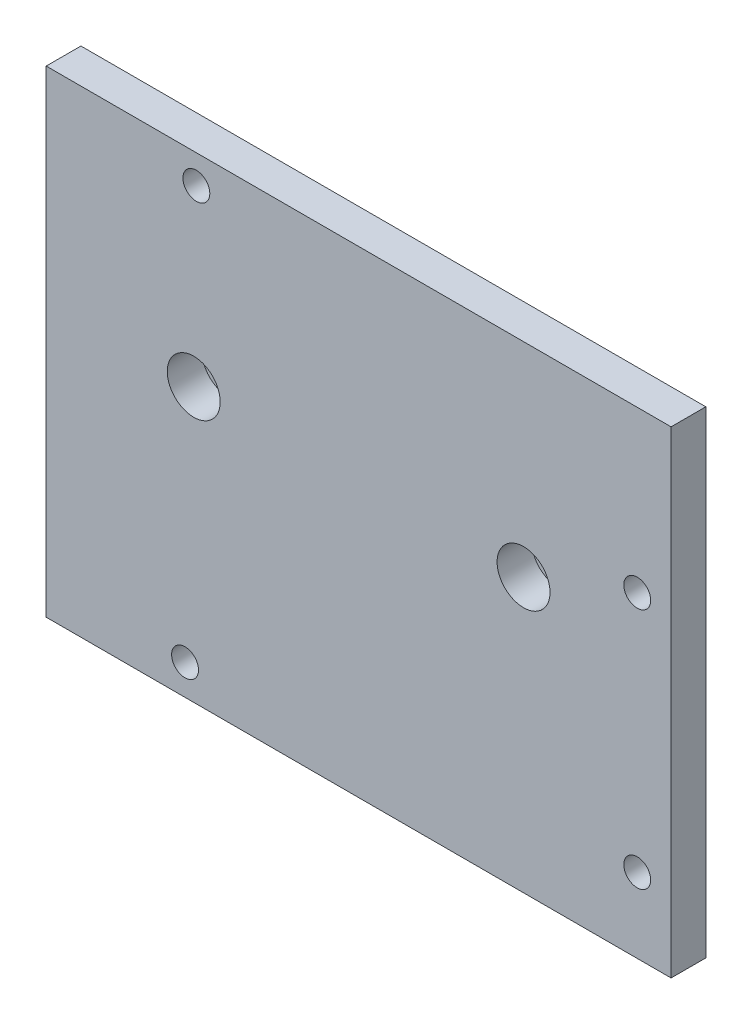
from build123d import *

# Parameters (mm, degrees)
SKETCH1_W           = 58
SKETCH1_H           = 12
SKETCH1_R           = 1.55
BOSS_EXTRUDE1_DEPTH = 6
SKETCH2_W           = 72
SKETCH2_H           = 55
SKETCH2_R           = 1.55
SKETCH2_R_2         = 3.05
BOSS_EXTRUDE2_DEPTH = 4


with BuildPart() as part:
    # Sketch1 → Boss-Extrude1 (new body)
    with BuildSketch(Plane.XY):
        Rectangle(SKETCH1_W, SKETCH1_H)
        with Locations((-19, 0)):
            Circle(SKETCH1_R, mode=Mode.SUBTRACT)
        with Locations((19, 0)):
            Circle(SKETCH1_R, mode=Mode.SUBTRACT)
    extrude(amount=BOSS_EXTRUDE1_DEPTH)

    # Sketch2 → Boss-Extrude2 (add)
    with BuildSketch(Plane.XY.offset(6)):
        with Locations((0, -4)):
            Rectangle(SKETCH2_W, SKETCH2_H)
        with Locations((32.1, 5)):
            Circle(SKETCH2_R, mode=Mode.SUBTRACT)
        with Locations((-20, -28)):
            Circle(SKETCH2_R, mode=Mode.SUBTRACT)
        with Locations((-18.7, 20.2)):
            Circle(SKETCH2_R, mode=Mode.SUBTRACT)
        with Locations((32.1, -22.9)):
            Circle(SKETCH2_R, mode=Mode.SUBTRACT)
        with Locations((-19, 0)):
            Circle(SKETCH2_R_2, mode=Mode.SUBTRACT)
        with Locations((19, 0)):
            Circle(SKETCH2_R_2, mode=Mode.SUBTRACT)
    extrude(amount=BOSS_EXTRUDE2_DEPTH)


solid = part.part
